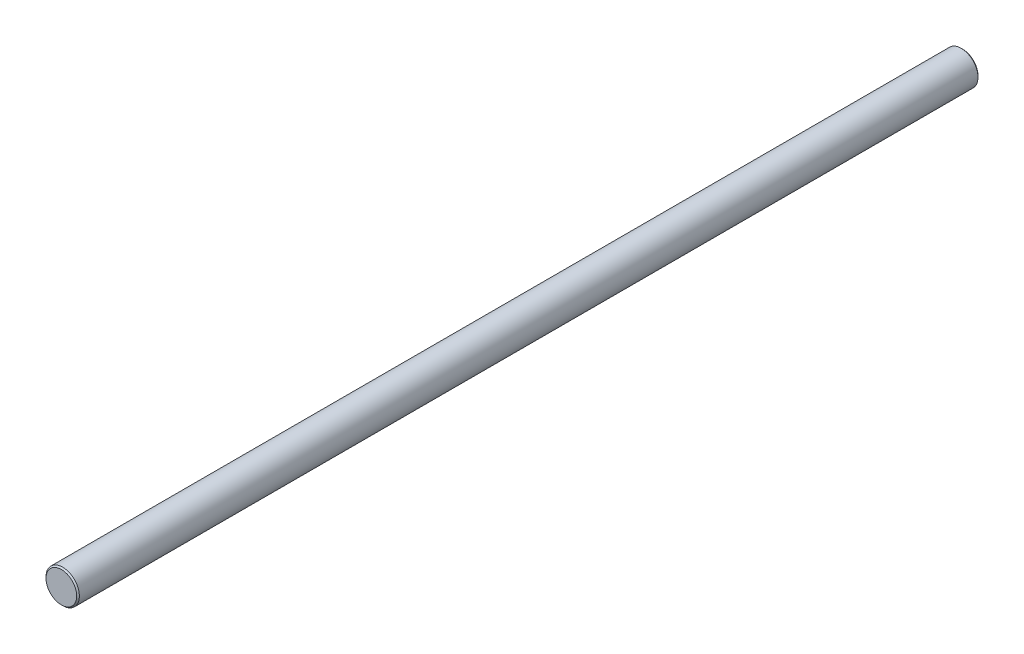
from build123d import *

# Parameters (mm, degrees)
SKETCH_1_R      = 2.5
EXTRUDE_1_DEPTH = 135
CHAMFER_1_SIZE  = 0.2
SCALE_1_SCALE   = 0.6


with BuildPart() as part:
    # 草图1 → 凸台-拉伸1 (new body)
    with BuildSketch(Plane.XY):
        Circle(SKETCH_1_R)
    extrude(amount=EXTRUDE_1_DEPTH)

    # 倒角1
    chamfer_1_edges = [part.edges().sort_by_distance(p)[0] for p in [
        (-2.5, 0, 0),
        (-2.5, 0, 135),
    ]]
    chamfer(chamfer_1_edges, length=CHAMFER_1_SIZE)


with BuildPart() as part_1:
    # 缩放比例1: scaled about (0, 0, 0)
    add(part.part.scale(SCALE_1_SCALE))


solid = part_1.part
